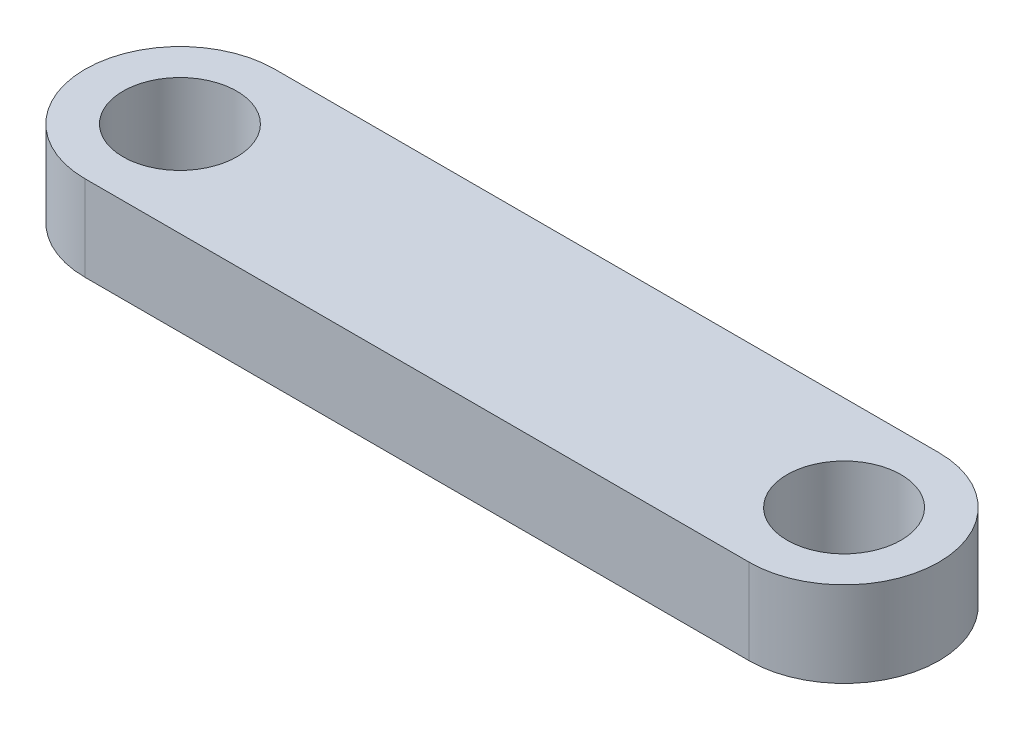
from build123d import *

# Parameters (mm, degrees)
SKETCH_1_R      = 3
EXTRUDE_1_DEPTH = 4.5


with BuildPart() as part:
    # 草图1 → 凸台-拉伸1 (new body)
    with BuildSketch(Plane(origin=(0, 0, 0), x_dir=(1, 0, 0), z_dir=(0, 1, 0))):
        with BuildLine():
            Line((-10, 5), (25, 5))
            ThreePointArc((25, 5), (30, 0), (25, -5))
            Line((25, -5), (-10, -5))
            ThreePointArc((-10, -5), (-15, 0), (-10, 5))
        make_face()
        with Locations(Location((-10, 0, 0), (0, 0, 270))):
            Circle(SKETCH_1_R, mode=Mode.SUBTRACT)
        with Locations(Location((25, 0, 0), (0, 0, 270))):
            Circle(SKETCH_1_R, mode=Mode.SUBTRACT)
    extrude(amount=EXTRUDE_1_DEPTH)


solid = part.part
